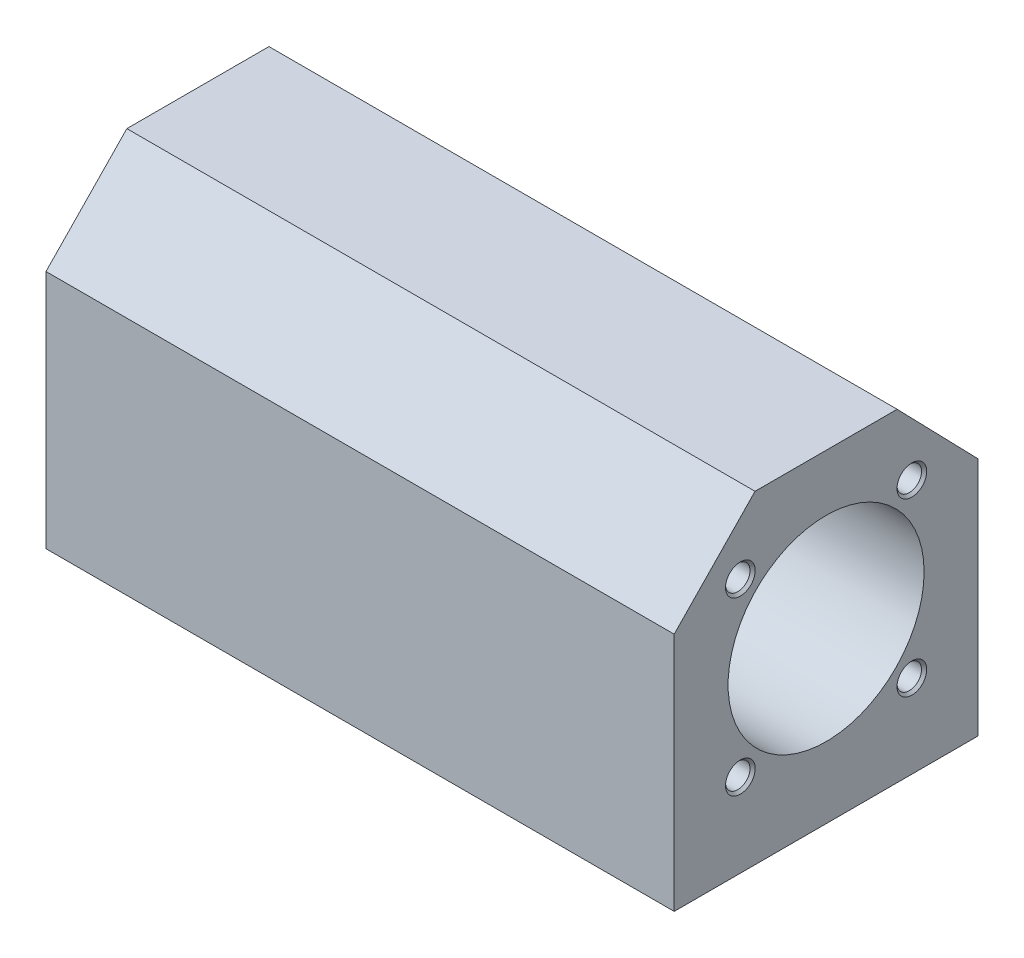
from build123d import *

# Parameters (mm, degrees)
RESSALTO_EXTRUS_O1_DEPTH        = 128.2
FURO_ROSCADO_DE_M61_D           = 5
FURO_ROSCADO_DE_M61_DEPTH       = 20.45
FURO_ROSCADO_DE_M61_CSINK_D     = 6.05
FURO_ROSCADO_DE_M61_CSINK_ANGLE = 90
FURO_ROSCADO_DE_M61_TIP         = 1.502151548
ESBO_O4_R                       = 12.5
CORTE_EXTRUS_O1_DEPTH           = 157.956172227
ESBO_O5_R                       = 29
CORTE_EXTRUS_O2_DEPTH           = 50
ESBO_O6_R                       = 20
CORTE_EXTRUS_O3_DEPTH           = 70


with BuildPart() as part:
    # Esboço1 → Ressalto-extrusão1 (new body)
    with BuildSketch(Plane(origin=(0, 0, 0), x_dir=(0, 0, -1), z_dir=(1, 0, 0))):
        Polygon((0, 49), (16.5, 66), (45.5, 66), (62, 49), (62, 0), (0, 0), align=None)
    extrude(amount=-RESSALTO_EXTRUS_O1_DEPTH)

    # Furo roscado de M61
    with Locations(Plane(origin=(0, 0, 0), x_dir=(0, 0, -1), z_dir=(1, 0, 0))):
        with Locations((13.5, 52), (48.5, 52), (48.5, 17), (13.5, 17)):
            CounterSinkHole(FURO_ROSCADO_DE_M61_D / 2, FURO_ROSCADO_DE_M61_CSINK_D / 2, depth=FURO_ROSCADO_DE_M61_DEPTH, counter_sink_angle=FURO_ROSCADO_DE_M61_CSINK_ANGLE)
            with Locations((0, 0, -(FURO_ROSCADO_DE_M61_DEPTH + FURO_ROSCADO_DE_M61_TIP / 2))):  # 118° drill point
                Cone(0, FURO_ROSCADO_DE_M61_D / 2, FURO_ROSCADO_DE_M61_TIP, mode=Mode.SUBTRACT)

    # Esboço4 → Corte-extrusão1 (cut, through all)
    with BuildSketch(Plane(origin=(0, 0, 0), x_dir=(0, 0, -1), z_dir=(1, 0, 0))):
        with Locations((31, 34.5)):
            Circle(ESBO_O4_R)
    extrude(amount=-CORTE_EXTRUS_O1_DEPTH, mode=Mode.SUBTRACT)

    # Esboço5 → Corte-extrusão2 (cut)
    with BuildSketch(Plane.ZY.offset(128.2)):
        with Locations((-31, 34.5)):
            Circle(ESBO_O5_R)
    extrude(amount=-CORTE_EXTRUS_O2_DEPTH, mode=Mode.SUBTRACT)

    # Esboço6 → Corte-extrusão3 (cut)
    with BuildSketch(Plane(origin=(0, 0, 0), x_dir=(0, 0, -1), z_dir=(1, 0, 0))):
        with Locations((31, 34.5)):
            Circle(ESBO_O6_R)
    extrude(amount=-CORTE_EXTRUS_O3_DEPTH, mode=Mode.SUBTRACT)


solid = part.part
